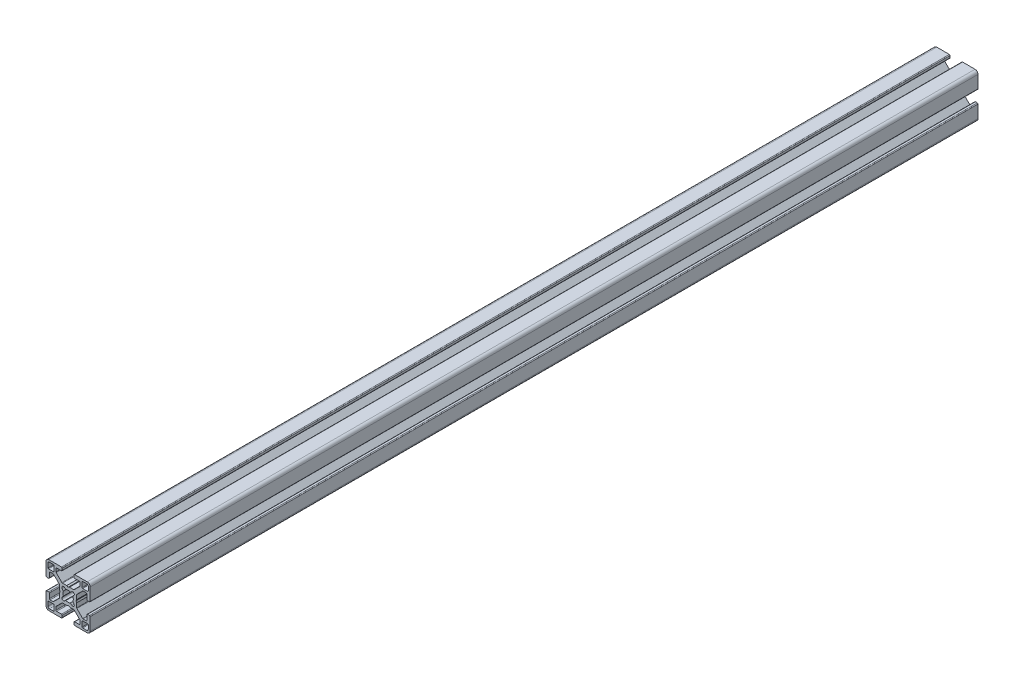
from build123d import *

# Parameters (mm, degrees)
EXTRUSION1_DEPTH = 603


with BuildPart() as part:
    # Esboço1 → Extrusion1 (new body)
    with BuildSketch(Plane.XY):
        with BuildLine():
            Line((-13, -15), (-4.508, -15))
            ThreePointArc((-4.508, -15), (-4.148789755, -14.851210245), (-4, -14.492))
            Line((-4, -14.492), (-4, -13.251))
            ThreePointArc((-4, -13.251), (-4.148789755, -12.891789755), (-4.508, -12.743))
            Line((-4.508, -12.743), (-7.742, -12.743))
            ThreePointArc((-7.742, -12.743), (-8.101210245, -12.594210245), (-8.25, -12.235))
            Line((-8.25, -12.235), (-8.25, -10.264165074))
            ThreePointArc((-8.25, -10.264165074), (-8.211330803, -10.06976189), (-8.101210245, -9.904954829))
            Line((-8.101210245, -9.904954829), (-4.179545171, -5.983289755))
            ThreePointArc((-4.179545171, -5.983289755), (-4.01473811, -5.873169197), (-3.820334926, -5.8345))
            Line((-3.820334926, -5.8345), (-0.949019985, -5.8345))
            Line((-0.949019985, -5.8345), (0, -5.325))
            Line((0, -5.325), (0.949019985, -5.8345))
            Line((0.949019985, -5.8345), (3.82157951, -5.8345))
            ThreePointArc((3.82157951, -5.8345), (4.015982694, -5.873169197), (4.180789755, -5.983289755))
            Line((4.180789755, -5.983289755), (8.101210245, -9.903710245))
            ThreePointArc((8.101210245, -9.903710245), (8.211330803, -10.068517306), (8.25, -10.26292049))
            Line((8.25, -10.26292049), (8.25, -12.235))
            ThreePointArc((8.25, -12.235), (8.101210245, -12.594210245), (7.742, -12.743))
            Line((7.742, -12.743), (4.508, -12.743))
            ThreePointArc((4.508, -12.743), (4.148789755, -12.891789755), (4, -13.251))
            Line((4, -13.251), (4, -14.492))
            ThreePointArc((4, -14.492), (4.148789755, -14.851210245), (4.508, -15))
            Line((4.508, -15), (13, -15))
            ThreePointArc((13, -15), (14.414213562, -14.414213562), (15, -13))
            Line((15, -13), (15, -4.508))
            ThreePointArc((15, -4.508), (14.851210245, -4.148789755), (14.492, -4))
            Line((14.492, -4), (13.251, -4))
            ThreePointArc((13.251, -4), (12.891789755, -4.148789755), (12.743, -4.508))
            Line((12.743, -4.508), (12.743, -7.742))
            ThreePointArc((12.743, -7.742), (12.594210245, -8.101210245), (12.235, -8.25))
            Line((12.235, -8.25), (10.264165074, -8.25))
            ThreePointArc((10.264165074, -8.25), (10.06976189, -8.211330803), (9.904954829, -8.101210245))
            Line((9.904954829, -8.101210245), (5.983289755, -4.179545171))
            ThreePointArc((5.983289755, -4.179545171), (5.873169197, -4.01473811), (5.8345, -3.820334926))
            Line((5.8345, -3.820334926), (5.8345, -0.949019985))
            Line((5.8345, -0.949019985), (5.325, 0))
            Line((5.325, 0), (5.8345, 0.949019985))
            Line((5.8345, 0.949019985), (5.8345, 3.82157951))
            ThreePointArc((5.8345, 3.82157951), (5.873169197, 4.015982694), (5.983289755, 4.180789755))
            Line((5.983289755, 4.180789755), (9.903710245, 8.101210245))
            ThreePointArc((9.903710245, 8.101210245), (10.068517306, 8.211330803), (10.26292049, 8.25))
            Line((10.26292049, 8.25), (12.235, 8.25))
            ThreePointArc((12.235, 8.25), (12.594210245, 8.101210245), (12.743, 7.742))
            Line((12.743, 7.742), (12.743, 4.508))
            ThreePointArc((12.743, 4.508), (12.891789755, 4.148789755), (13.251, 4))
            Line((13.251, 4), (14.492, 4))
            ThreePointArc((14.492, 4), (14.851210245, 4.148789755), (15, 4.508))
            Line((15, 4.508), (15, 13))
            ThreePointArc((15, 13), (14.414213562, 14.414213562), (13, 15))
            Line((13, 15), (4.508, 15))
            ThreePointArc((4.508, 15), (4.148789755, 14.851210245), (4, 14.492))
            Line((4, 14.492), (4, 13.251))
            ThreePointArc((4, 13.251), (4.148789755, 12.891789755), (4.508, 12.743))
            Line((4.508, 12.743), (7.742, 12.743))
            ThreePointArc((7.742, 12.743), (8.101210245, 12.594210245), (8.25, 12.235))
            Line((8.25, 12.235), (8.25, 10.264165074))
            ThreePointArc((8.25, 10.264165074), (8.211330803, 10.06976189), (8.101210245, 9.904954829))
            Line((8.101210245, 9.904954829), (4.179545171, 5.983289755))
            ThreePointArc((4.179545171, 5.983289755), (4.01473811, 5.873169197), (3.820334926, 5.8345))
            Line((3.820334926, 5.8345), (0.949019985, 5.8345))
            Line((0.949019985, 5.8345), (0, 5.325))
            Line((0, 5.325), (-0.949019985, 5.8345))
            Line((-0.949019985, 5.8345), (-3.82157951, 5.8345))
            ThreePointArc((-3.82157951, 5.8345), (-4.015982694, 5.873169197), (-4.180789755, 5.983289755))
            Line((-4.180789755, 5.983289755), (-8.101210245, 9.903710245))
            ThreePointArc((-8.101210245, 9.903710245), (-8.211330803, 10.068517306), (-8.25, 10.26292049))
            Line((-8.25, 10.26292049), (-8.25, 12.235))
            ThreePointArc((-8.25, 12.235), (-8.101210245, 12.594210245), (-7.742, 12.743))
            Line((-7.742, 12.743), (-4.508, 12.743))
            ThreePointArc((-4.508, 12.743), (-4.148789755, 12.891789755), (-4, 13.251))
            Line((-4, 13.251), (-4, 14.492))
            ThreePointArc((-4, 14.492), (-4.148789755, 14.851210245), (-4.508, 15))
            Line((-4.508, 15), (-13, 15))
            ThreePointArc((-13, 15), (-14.414213562, 14.414213562), (-15, 13))
            Line((-15, 13), (-15, 4.508))
            ThreePointArc((-15, 4.508), (-14.851210245, 4.148789755), (-14.492, 4))
            Line((-14.492, 4), (-13.251, 4))
            ThreePointArc((-13.251, 4), (-12.891789755, 4.148789755), (-12.743, 4.508))
            Line((-12.743, 4.508), (-12.743, 7.742))
            ThreePointArc((-12.743, 7.742), (-12.594210245, 8.101210245), (-12.235, 8.25))
            Line((-12.235, 8.25), (-10.264165074, 8.25))
            ThreePointArc((-10.264165074, 8.25), (-10.06976189, 8.211330803), (-9.904954829, 8.101210245))
            Line((-9.904954829, 8.101210245), (-5.983289755, 4.179545171))
            ThreePointArc((-5.983289755, 4.179545171), (-5.873169197, 4.01473811), (-5.8345, 3.820334926))
            Line((-5.8345, 3.820334926), (-5.8345, 0.949019985))
            Line((-5.8345, 0.949019985), (-5.325, 0))
            Line((-5.325, 0), (-5.8345, -0.949019985))
            Line((-5.8345, -0.949019985), (-5.8345, -3.82157951))
            ThreePointArc((-5.8345, -3.82157951), (-5.873169197, -4.015982694), (-5.983289755, -4.180789755))
            Line((-5.983289755, -4.180789755), (-9.903710245, -8.101210245))
            ThreePointArc((-9.903710245, -8.101210245), (-10.068517306, -8.211330803), (-10.26292049, -8.25))
            Line((-10.26292049, -8.25), (-12.235, -8.25))
            ThreePointArc((-12.235, -8.25), (-12.594210245, -8.101210245), (-12.743, -7.742))
            Line((-12.743, -7.742), (-12.743, -4.508))
            ThreePointArc((-12.743, -4.508), (-12.891789755, -4.148789755), (-13.251, -4))
            Line((-13.251, -4), (-14.492, -4))
            ThreePointArc((-14.492, -4), (-14.851210245, -4.148789755), (-15, -4.508))
            Line((-15, -4.508), (-15, -13))
            ThreePointArc((-15, -13), (-14.414213562, -14.414213562), (-13, -15))
        make_face()
        with BuildLine():
            Line((9.5, 13.319), (9.5, 9.881))
            ThreePointArc((9.5, 9.881), (9.611592316, 9.611592316), (9.881, 9.5))
            Line((9.881, 9.5), (13.319, 9.5))
            ThreePointArc((13.319, 9.5), (13.588407684, 9.611592316), (13.7, 9.881))
            Line((13.7, 9.881), (13.7, 12.7))
            ThreePointArc((13.7, 12.7), (13.407106781, 13.407106781), (12.7, 13.7))
            Line((12.7, 13.7), (9.881, 13.7))
            ThreePointArc((9.881, 13.7), (9.611592316, 13.588407684), (9.5, 13.319))
        make_face(mode=Mode.SUBTRACT)
        with BuildLine():
            Line((9.5, -9.881), (9.5, -13.319))
            ThreePointArc((9.5, -13.319), (9.611592316, -13.588407684), (9.881, -13.7))
            Line((9.881, -13.7), (12.7, -13.7))
            ThreePointArc((12.7, -13.7), (13.407106781, -13.407106781), (13.7, -12.7))
            Line((13.7, -12.7), (13.7, -9.881))
            ThreePointArc((13.7, -9.881), (13.588407684, -9.611592316), (13.319, -9.5))
            Line((13.319, -9.5), (9.881, -9.5))
            ThreePointArc((9.881, -9.5), (9.611592316, -9.611592316), (9.5, -9.881))
        make_face(mode=Mode.SUBTRACT)
        with BuildLine():
            Line((-13.7, -9.881), (-13.7, -12.7))
            ThreePointArc((-13.7, -12.7), (-13.407106781, -13.407106781), (-12.7, -13.7))
            Line((-12.7, -13.7), (-9.881, -13.7))
            ThreePointArc((-9.881, -13.7), (-9.611592316, -13.588407684), (-9.5, -13.319))
            Line((-9.5, -13.319), (-9.5, -9.881))
            ThreePointArc((-9.5, -9.881), (-9.611592316, -9.611592316), (-9.881, -9.5))
            Line((-9.881, -9.5), (-13.319, -9.5))
            ThreePointArc((-13.319, -9.5), (-13.588407684, -9.611592316), (-13.7, -9.881))
        make_face(mode=Mode.SUBTRACT)
        with BuildLine():
            Line((-13.7, 12.7), (-13.7, 9.881))
            ThreePointArc((-13.7, 9.881), (-13.588407684, 9.611592316), (-13.319, 9.5))
            Line((-13.319, 9.5), (-9.881, 9.5))
            ThreePointArc((-9.881, 9.5), (-9.611592316, 9.611592316), (-9.5, 9.881))
            Line((-9.5, 9.881), (-9.5, 13.319))
            ThreePointArc((-9.5, 13.319), (-9.611592316, 13.588407684), (-9.881, 13.7))
            Line((-9.881, 13.7), (-12.7, 13.7))
            ThreePointArc((-12.7, 13.7), (-13.407106781, 13.407106781), (-13.7, 12.7))
        make_face(mode=Mode.SUBTRACT)
        with BuildLine():
            Line((-4.010726841, 2.5139095), (-3.198163609, 1.494205317))
            ThreePointArc((-3.198163609, 1.494205317), (-3.53, 0), (-3.198163609, -1.494205317))
            Line((-3.198163609, -1.494205317), (-4.010726841, -2.5139095))
            ThreePointArc((-4.010726841, -2.5139095), (-3.900018469, -3.900018469), (-2.5139095, -4.010726841))
            Line((-2.5139095, -4.010726841), (-1.494205317, -3.198163609))
            ThreePointArc((-1.494205317, -3.198163609), (0, -3.53), (1.494205317, -3.198163609))
            Line((1.494205317, -3.198163609), (2.5139095, -4.010726841))
            ThreePointArc((2.5139095, -4.010726841), (3.900018469, -3.900018469), (4.010726841, -2.5139095))
            Line((4.010726841, -2.5139095), (3.198163609, -1.494205317))
            ThreePointArc((3.198163609, -1.494205317), (3.53, 0), (3.198163609, 1.494205317))
            Line((3.198163609, 1.494205317), (4.010726841, 2.5139095))
            ThreePointArc((4.010726841, 2.5139095), (3.900018469, 3.900018469), (2.5139095, 4.010726841))
            Line((2.5139095, 4.010726841), (1.494205317, 3.198163609))
            ThreePointArc((1.494205317, 3.198163609), (0, 3.53), (-1.494205317, 3.198163609))
            Line((-1.494205317, 3.198163609), (-2.5139095, 4.010726841))
            ThreePointArc((-2.5139095, 4.010726841), (-3.900018469, 3.900018469), (-4.010726841, 2.5139095))
        make_face(mode=Mode.SUBTRACT)
    extrude(amount=-EXTRUSION1_DEPTH)


solid = part.part
